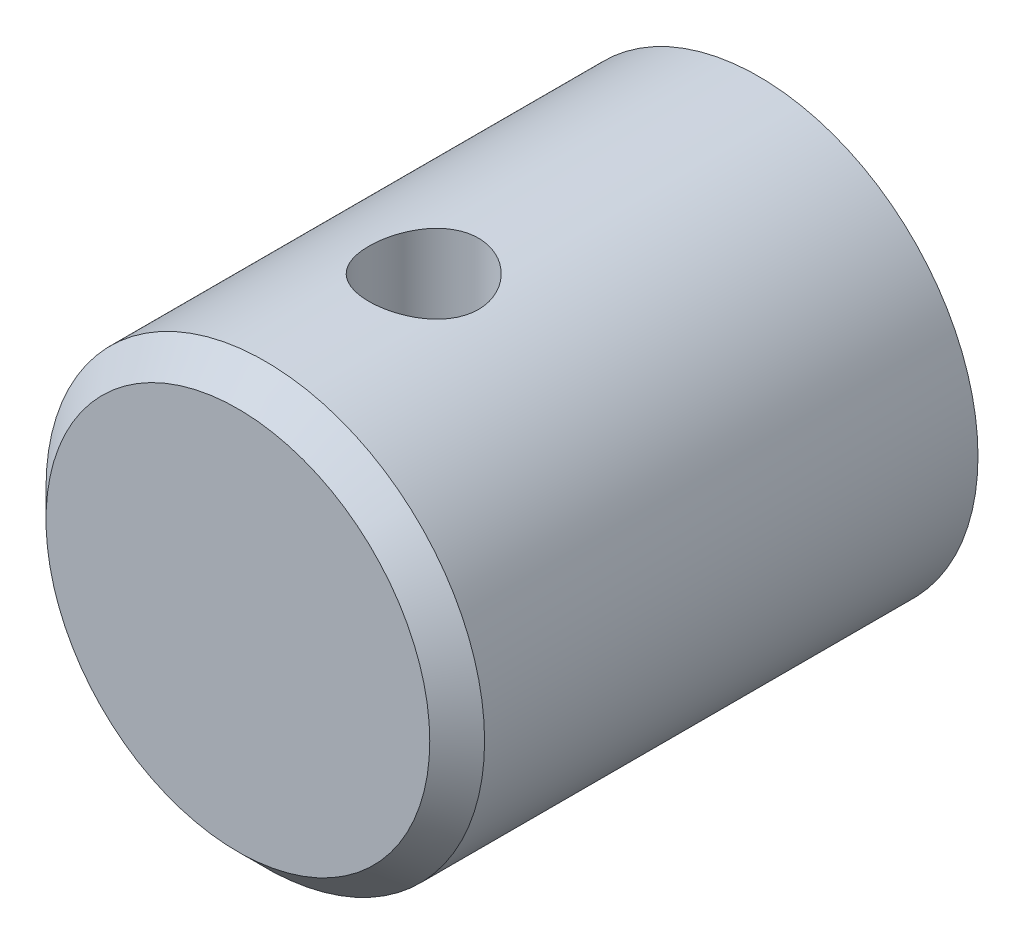
from build123d import *

# Parameters (mm, degrees)
SKETCH1_R           = 8
BOSS_EXTRUDE1_DEPTH = 19
SKETCH2_R           = 2
CUT_EXTRUDE1_DEPTH  = 24
CHAMFER1_SIZE       = 1


with BuildPart() as part:
    # Sketch1 → Boss-Extrude1 (new body)
    with BuildSketch(Plane.XY):
        Circle(SKETCH1_R)
    extrude(amount=BOSS_EXTRUDE1_DEPTH)

    # Sketch2 → Cut-Extrude1 (cut, symmetric)
    with BuildSketch(Plane(origin=(0, 0, 0), x_dir=(1, 0, 0), z_dir=(0, 1, 0))):
        with Locations(Location((0, -12.221312154, 0), (0, 0, 270))):
            Circle(SKETCH2_R)
    extrude(amount=CUT_EXTRUDE1_DEPTH, both=True, mode=Mode.SUBTRACT)

    # Chamfer1
    chamfer1_edges = [part.edges().sort_by_distance(p)[0] for p in [
        (-8, 0, 19),
    ]]
    chamfer(chamfer1_edges, length=CHAMFER1_SIZE)


solid = part.part
